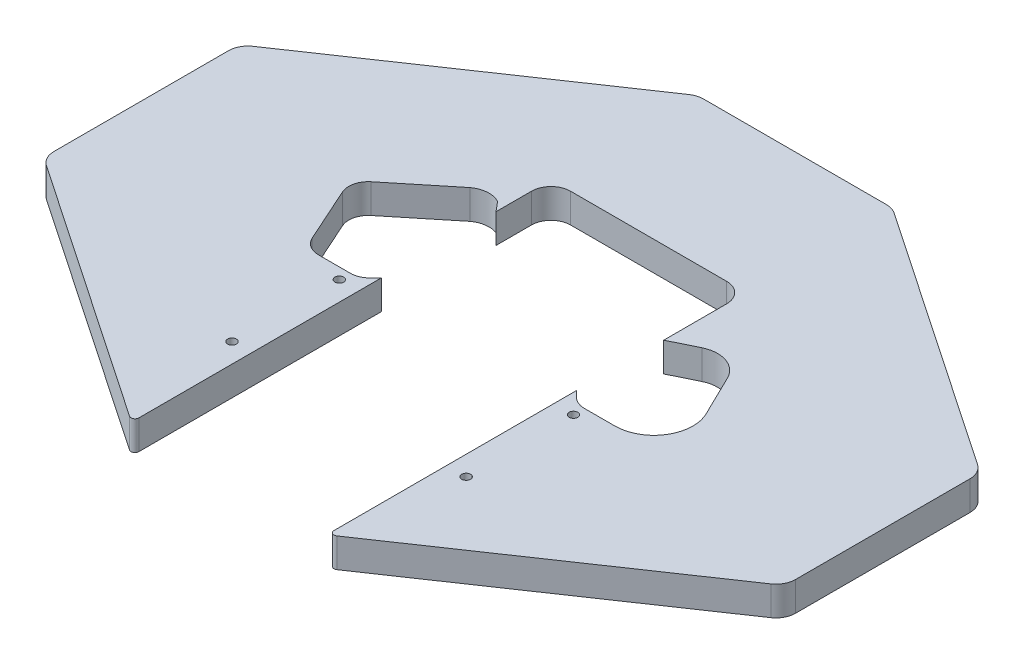
from build123d import *

# Parameters (mm, degrees)
BOSS_EXTRU_1_DEPTH       = 15
ESQUISSE6_W              = 100
ESQUISSE6_H              = 15
ENL_V_MAT_EXTRU_1_DEPTH  = 215
ENL_V_MAT_EXTRU_10_REACH = 393.106
ESQUISSE11_R             = 2.25
ENL_V_MAT_EXTRU_11_REACH = 393.106
ESQUISSE8_R              = 2.25
CONG_10_R                = 10
CONG_11_R                = 2
ENL_V_MAT_EXTRU_12_REACH = 391.991


with BuildPart() as part:
    # Esquisse1 → Boss.-Extru.1 (new body)
    with BuildSketch(Plane(origin=(0, 0, 0), x_dir=(1, 0, 0), z_dir=(0, 1, 0))):
        Polygon((-76.643189126, -51.401333399), (63.356810874, 43.598666601), (163.356810874, 43.598666601), (303.356810874, -51.401333399), (303.356810874, -151.401333399), (163.356810874, -246.401333399), (63.356810874, -246.401333399), (-76.643189126, -151.401333399), align=None)
    extrude(amount=BOSS_EXTRU_1_DEPTH)

    # Esquisse6 → Enlèv. mat.-Extru.1 (cut)
    with BuildSketch(Plane.XY.offset(246.401333399)):
        with Locations((113.356810874, 7.5)):
            Rectangle(ESQUISSE6_W, ESQUISSE6_H)
    extrude(amount=-ENL_V_MAT_EXTRU_1_DEPTH, mode=Mode.SUBTRACT)

    # Esquisse11 → Enlèv. mat.-Extru.10 (cut, up to next)
    with BuildSketch(Plane(origin=(0, 15, 0), x_dir=(1, 0, 0), z_dir=(0, 1, 0)), mode=Mode.PRIVATE) as enl_v_mat_extru_10_sk1:
        with Locations(Location((53.356810874, -129.901333399, 0), (0, 0, 270))):
            Circle(ESQUISSE11_R)
    enl_v_mat_extru_10_tool1 = extrude(enl_v_mat_extru_10_sk1.sketch, amount=-ENL_V_MAT_EXTRU_10_REACH, mode=Mode.PRIVATE) & part.part
    # Esquisse11 → Enlèv. mat.-Extru.10 (cut, up to next)
    with BuildSketch(Plane(origin=(0, 15, 0), x_dir=(1, 0, 0), z_dir=(0, 1, 0)), mode=Mode.PRIVATE) as enl_v_mat_extru_10_sk2:
        with Locations(Location((53.356810874, -184.901333399, 0), (0, 0, 270))):
            Circle(ESQUISSE11_R)
    enl_v_mat_extru_10_tool2 = extrude(enl_v_mat_extru_10_sk2.sketch, amount=-ENL_V_MAT_EXTRU_10_REACH, mode=Mode.PRIVATE) & part.part
    # Esquisse11 → Enlèv. mat.-Extru.10 (cut, up to next)
    with BuildSketch(Plane(origin=(0, 15, 0), x_dir=(1, 0, 0), z_dir=(0, 1, 0)), mode=Mode.PRIVATE) as enl_v_mat_extru_10_sk3:
        with Locations(Location((173.356810874, -129.901333399, 0), (0, 0, 270))):
            Circle(ESQUISSE11_R)
    enl_v_mat_extru_10_tool3 = extrude(enl_v_mat_extru_10_sk3.sketch, amount=-ENL_V_MAT_EXTRU_10_REACH, mode=Mode.PRIVATE) & part.part
    # Esquisse11 → Enlèv. mat.-Extru.10 (cut, up to next)
    with BuildSketch(Plane(origin=(0, 15, 0), x_dir=(1, 0, 0), z_dir=(0, 1, 0)), mode=Mode.PRIVATE) as enl_v_mat_extru_10_sk4:
        with Locations(Location((173.356810874, -184.901333399, 0), (0, 0, 270))):
            Circle(ESQUISSE11_R)
    enl_v_mat_extru_10_tool4 = extrude(enl_v_mat_extru_10_sk4.sketch, amount=-ENL_V_MAT_EXTRU_10_REACH, mode=Mode.PRIVATE) & part.part
    add(enl_v_mat_extru_10_tool1.solids().sort_by_distance((53.356811, 15, 129.901333))[0], mode=Mode.SUBTRACT)
    add(enl_v_mat_extru_10_tool2.solids().sort_by_distance((53.356811, 15, 184.901333))[0], mode=Mode.SUBTRACT)
    add(enl_v_mat_extru_10_tool3.solids().sort_by_distance((173.356811, 15, 129.901333))[0], mode=Mode.SUBTRACT)
    add(enl_v_mat_extru_10_tool4.solids().sort_by_distance((173.356811, 15, 184.901333))[0], mode=Mode.SUBTRACT)

    # Esquisse8 → Enlèv. mat.-Extru.11 (cut, up to next)
    with BuildSketch(Plane(origin=(0, 15, 0), x_dir=(1, 0, 0), z_dir=(0, 1, 0)), mode=Mode.PRIVATE) as enl_v_mat_extru_11_sk1:
        with Locations(Location((180.356810874, -120.901333399, 0), (0, 0, 270))):
            Circle(ESQUISSE8_R)
    enl_v_mat_extru_11_tool1 = extrude(enl_v_mat_extru_11_sk1.sketch, amount=-ENL_V_MAT_EXTRU_11_REACH, mode=Mode.PRIVATE) & part.part
    # Esquisse8 → Enlèv. mat.-Extru.11 (cut, up to next)
    with BuildSketch(Plane(origin=(0, 15, 0), x_dir=(1, 0, 0), z_dir=(0, 1, 0)), mode=Mode.PRIVATE) as enl_v_mat_extru_11_sk2:
        with Locations(Location((180.356810874, -81.901333399, 0), (0, 0, 270))):
            Circle(ESQUISSE8_R)
    enl_v_mat_extru_11_tool2 = extrude(enl_v_mat_extru_11_sk2.sketch, amount=-ENL_V_MAT_EXTRU_11_REACH, mode=Mode.PRIVATE) & part.part
    # Esquisse8 → Enlèv. mat.-Extru.11 (cut, up to next)
    with BuildSketch(Plane(origin=(0, 15, 0), x_dir=(1, 0, 0), z_dir=(0, 1, 0)), mode=Mode.PRIVATE) as enl_v_mat_extru_11_sk3:
        with Locations(Location((46.356810874, -120.901333399, 0), (0, 0, 270))):
            Circle(ESQUISSE8_R)
    enl_v_mat_extru_11_tool3 = extrude(enl_v_mat_extru_11_sk3.sketch, amount=-ENL_V_MAT_EXTRU_11_REACH, mode=Mode.PRIVATE) & part.part
    # Esquisse8 → Enlèv. mat.-Extru.11 (cut, up to next)
    with BuildSketch(Plane(origin=(0, 15, 0), x_dir=(1, 0, 0), z_dir=(0, 1, 0)), mode=Mode.PRIVATE) as enl_v_mat_extru_11_sk4:
        with Locations(Location((46.356810874, -81.901333399, 0), (0, 0, 270))):
            Circle(ESQUISSE8_R)
    enl_v_mat_extru_11_tool4 = extrude(enl_v_mat_extru_11_sk4.sketch, amount=-ENL_V_MAT_EXTRU_11_REACH, mode=Mode.PRIVATE) & part.part
    add(enl_v_mat_extru_11_tool1.solids().sort_by_distance((180.356811, 15, 120.901333))[0], mode=Mode.SUBTRACT)
    add(enl_v_mat_extru_11_tool2.solids().sort_by_distance((180.356811, 15, 81.901333))[0], mode=Mode.SUBTRACT)
    add(enl_v_mat_extru_11_tool3.solids().sort_by_distance((46.356811, 15, 120.901333))[0], mode=Mode.SUBTRACT)
    add(enl_v_mat_extru_11_tool4.solids().sort_by_distance((46.356811, 15, 81.901333))[0], mode=Mode.SUBTRACT)

    # Congé10
    cong_10_edges = [part.edges().sort_by_distance(p)[0] for p in [
        (-76.643189126, 7.5, 51.401333399),
        (63.356810874, 7.5, -43.598666601),
        (163.356810874, 7.5, -43.598666601),
        (303.356810874, 7.5, 51.401333399),
        (303.356810874, 7.5, 151.401333399),
        (-76.643189126, 7.5, 151.401333399),
        (63.356810874, 7.5, 31.401333399),
        (163.356810874, 7.5, 31.401333399),
    ]]
    fillet(cong_10_edges, radius=CONG_10_R)

    # Congé11
    cong_11_edges = [part.edges().sort_by_distance(p)[0] for p in [
        (163.356810874, 7.5, 246.401333399),
        (63.356810874, 7.5, 246.401333399),
    ]]
    fillet(cong_11_edges, radius=CONG_11_R)

    # Esquisse12 → Enlèv. mat.-Extru.12 (cut, up to next)
    with BuildSketch(Plane(origin=(0, 15, 0), x_dir=(1, 0, 0), z_dir=(0, 1, 0)), mode=Mode.PRIVATE) as enl_v_mat_extru_12_sk1:
        with BuildLine():
            Line((46.009256573, -55.538188752), (18.058498347, -78.315798735))
            ThreePointArc((18.058498347, -78.315798735), (14.643777091, -83.767882822), (15.256670784, -90.171780344))
            Line((15.256670784, -90.171780344), (27.943631129, -118.361875593))
            ThreePointArc((27.943631129, -118.361875593), (31.633138728, -122.655474578), (37.06267458, -124.257847507))
            Line((37.06267458, -124.257847507), (53.356810874, -124.257847507))
            ThreePointArc((53.356810874, -124.257847507), (57.183645198, -123.496642832), (60.427878686, -121.328915318))
            Line((60.427878686, -121.328915318), (63.356810874, -118.39998313))
            Line((63.356810874, -118.39998313), (63.356810874, -59.592280682))
            Line((63.356810874, -59.592280682), (59.121809419, -54.561118788))
            ThreePointArc((59.121809419, -54.561118788), (52.42687157, -53.188778562), (46.009256573, -55.538188752))
        make_face()
    enl_v_mat_extru_12_tool1 = extrude(enl_v_mat_extru_12_sk1.sketch, amount=-ENL_V_MAT_EXTRU_12_REACH, mode=Mode.PRIVATE) & part.part
    # Esquisse12 → Enlèv. mat.-Extru.12 (cut, up to next)
    with BuildSketch(Plane(origin=(0, 15, 0), x_dir=(1, 0, 0), z_dir=(0, 1, 0)), mode=Mode.PRIVATE) as enl_v_mat_extru_12_sk2:
        with BuildLine():
            Line((166.285743062, -121.328915318), (163.356810874, -118.39998313))
            Line((163.356810874, -118.39998313), (163.356810874, -73.642376596))
            Line((163.356810874, -73.642376596), (176.462200108, -67.250451181))
            ThreePointArc((176.462200108, -67.250451181), (187.921289626, -66.549583242), (196.519678004, -74.156794674))
            Line((196.519678004, -74.156794674), (206.924784537, -95.490424571))
            ThreePointArc((206.924784537, -95.490424571), (205.909865534, -114.856232791), (188.948903611, -124.257847507))
            Line((188.948903611, -124.257847507), (173.356810874, -124.257847507))
            ThreePointArc((173.356810874, -124.257847507), (169.529976551, -123.496642832), (166.285743062, -121.328915318))
        make_face()
    enl_v_mat_extru_12_tool2 = extrude(enl_v_mat_extru_12_sk2.sketch, amount=-ENL_V_MAT_EXTRU_12_REACH, mode=Mode.PRIVATE) & part.part
    add(enl_v_mat_extru_12_tool1.solids().sort_by_distance((43.070441, 15, 90.852572))[0], mode=Mode.SUBTRACT)
    add(enl_v_mat_extru_12_tool2.solids().sort_by_distance((183.873626, 15, 97.045657))[0], mode=Mode.SUBTRACT)


solid = part.part
